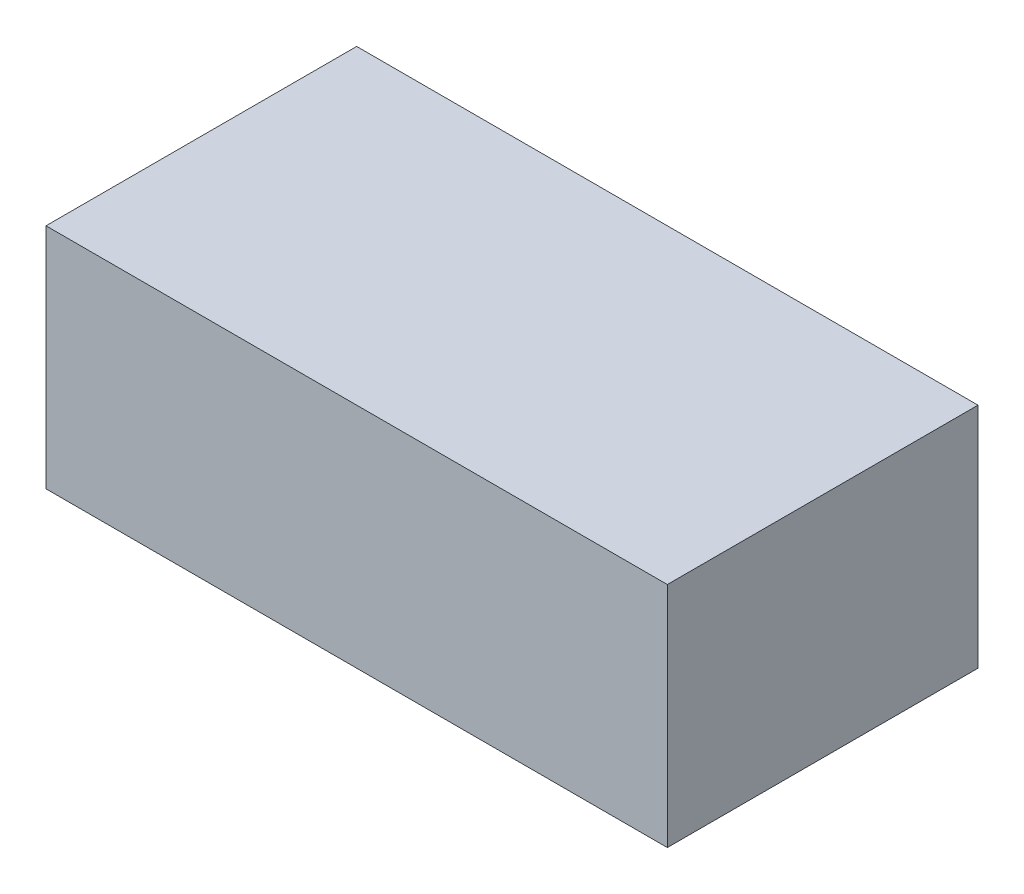
from build123d import *

# Parameters (mm, degrees)
SKETCH1_W           = 60
SKETCH1_H           = 30
BOSS_EXTRUDE1_DEPTH = 22


with BuildPart() as part:
    # Sketch1 → Boss-Extrude1 (new body)
    with BuildSketch(Plane(origin=(0, 0, 0), x_dir=(1, 0, 0), z_dir=(0, 1, 0))):
        with Locations((10.3514377, -4.984025559)):
            Rectangle(SKETCH1_W, SKETCH1_H)
    extrude(amount=BOSS_EXTRUDE1_DEPTH)


solid = part.part
